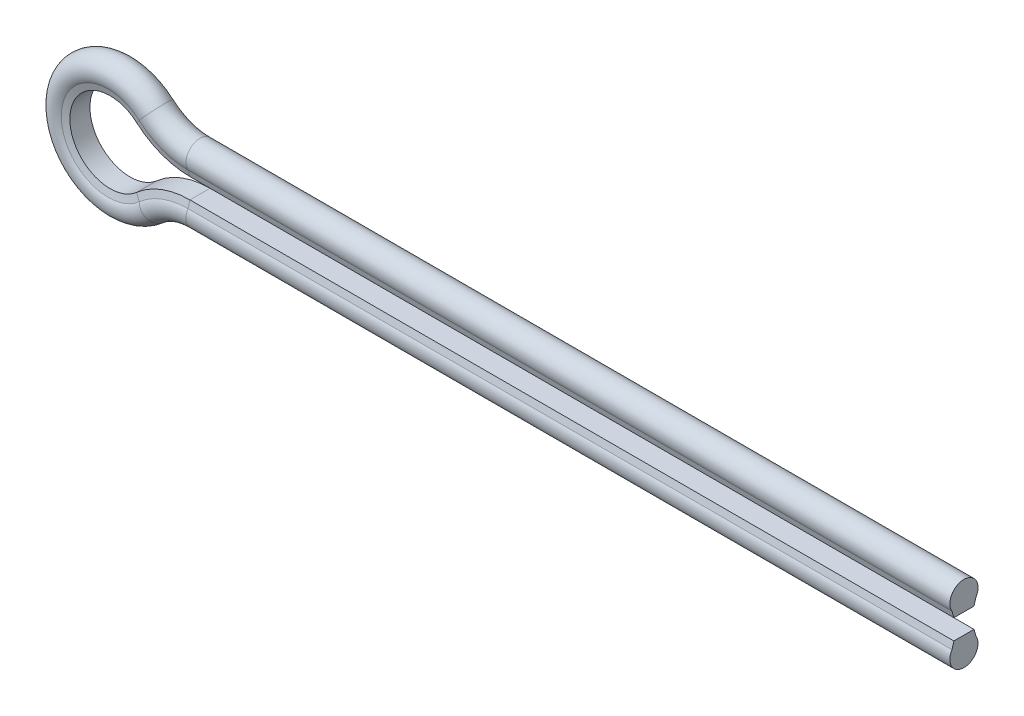
from build123d import *


with BuildPart() as part:
    # Sweep2: sweep along a path in Sketch1
    with BuildLine(Plane.XY) as sweep2_path:
        Line((0, 0), (-94.919661766, 0))
        ThreePointArc((-94.919661766, 0), (-98.455195672, 0.645856533), (-101.534040044, 2.5))
        ThreePointArc((-101.534040044, 2.5), (-109.841229183, -1.25), (-101.534040044, -5))
        ThreePointArc((-101.534040044, -5), (-98.455195672, -3.145856533), (-94.919661766, -2.5))
        Line((-94.919661766, -2.5), (0, -2.5))
    # Sketch2 → Sweep2 (sweep)
    with BuildSketch(Plane(origin=(0, 0, 0), x_dir=(0, 0, -1), z_dir=(1, 0, 0))):
        with BuildLine():
            Line((-1.25, 0), (1.25, 0))
            Line((1.25, 0), (1.485849057, 0.825471698))
            ThreePointArc((1.485849057, 0.825471698), (0, 3.5), (-1.485849057, 0.825471698))
            Line((-1.485849057, 0.825471698), (-1.25, 0))
        make_face()
    sweep(path=sweep2_path.line)


solid = part.part
